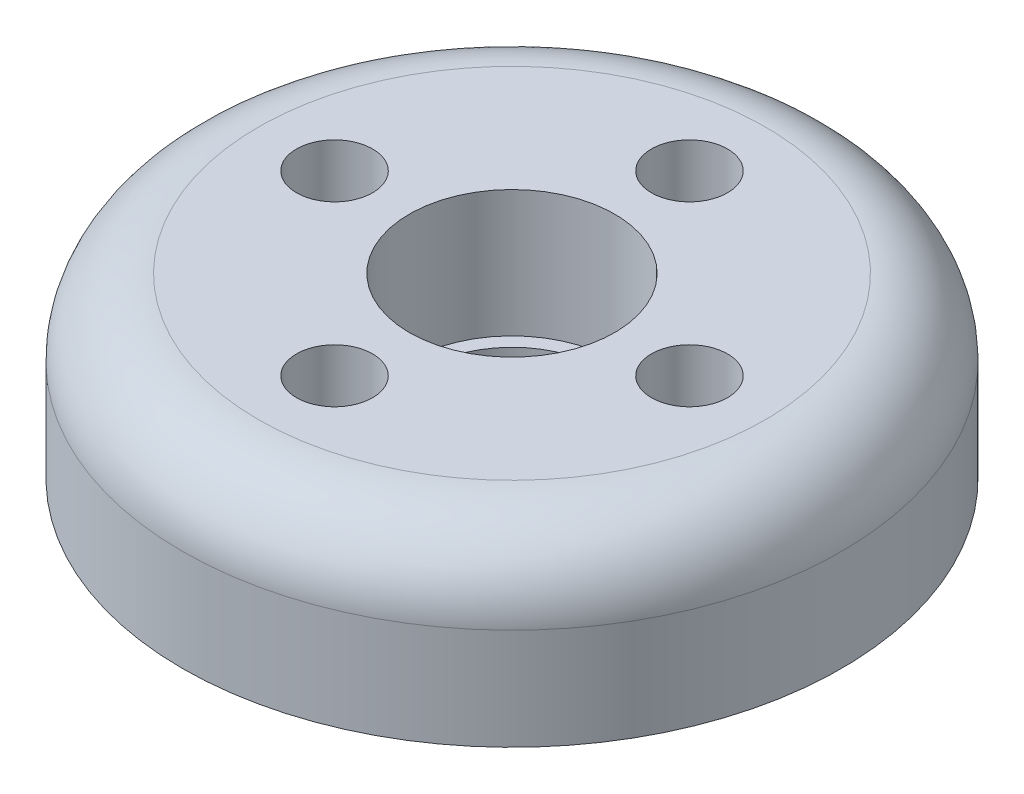
from build123d import *

# Parameters (mm, degrees)
SKETCH1_R           = 13
SKETCH1_R_2         = 3.5
SKETCH1_R_3         = 1.5
BOSS_EXTRUDE1_DEPTH = 7
SKETCH2_R           = 4.05
CUT_EXTRUDE1_DEPTH  = 5
FILLET1_R           = 3


with BuildPart() as part:
    # Sketch1 → Boss-Extrude1 (new body)
    with BuildSketch(Plane(origin=(0, 0, 0), x_dir=(1, 0, 0), z_dir=(0, 1, 0))):
        with Locations(Location((0, 0, 0), (0, 0, 270))):
            Circle(SKETCH1_R)
        with Locations(Location((0, 0, 0), (0, 0, 270))):
            Circle(SKETCH1_R_2, mode=Mode.SUBTRACT)
        with Locations(Location((0, 7, 0), (0, 0, 270))):
            Circle(SKETCH1_R_3, mode=Mode.SUBTRACT)
        with Locations(Location((7, 0, 0), (0, 0, 270))):
            Circle(SKETCH1_R_3, mode=Mode.SUBTRACT)
        with Locations(Location((0, -7, 0), (0, 0, 270))):
            Circle(SKETCH1_R_3, mode=Mode.SUBTRACT)
        with Locations(Location((-7, 0, 0), (0, 0, 270))):
            Circle(SKETCH1_R_3, mode=Mode.SUBTRACT)
    extrude(amount=BOSS_EXTRUDE1_DEPTH)

    # Sketch2 → Cut-Extrude1 (cut)
    with BuildSketch(Plane(origin=(0, 7, 0), x_dir=(1, 0, 0), z_dir=(0, 1, 0))):
        with Locations(Location((0, 0, 0), (0, 0, 270))):
            Circle(SKETCH2_R)
    extrude(amount=-CUT_EXTRUDE1_DEPTH, mode=Mode.SUBTRACT)

    # Fillet1
    fillet1_edges = [part.edges().sort_by_distance(p)[0] for p in [
        (0, 7, -13),
    ]]
    fillet(fillet1_edges, radius=FILLET1_R)


solid = part.part
